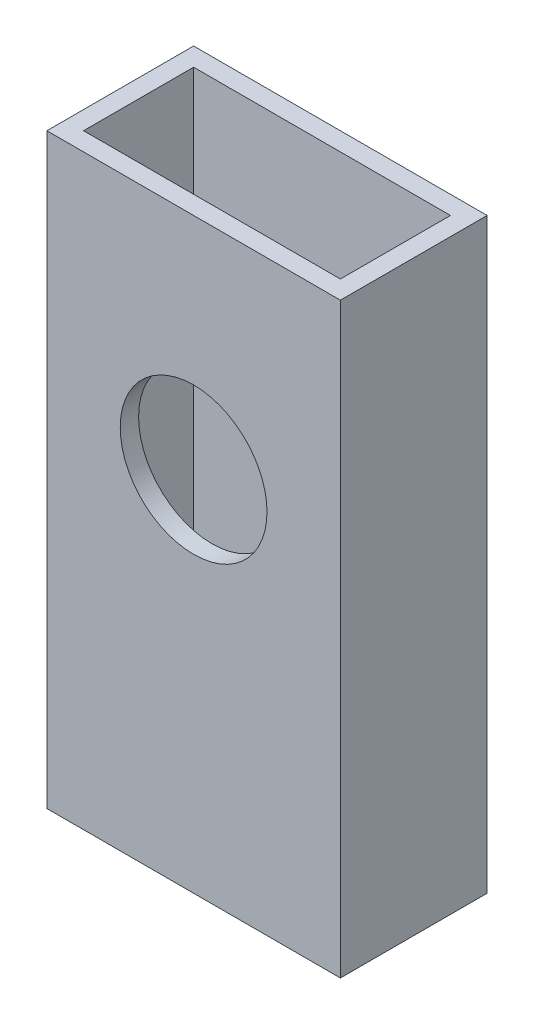
from build123d import *

# Parameters (mm, degrees)
SKETCH1_W           = 50.8
SKETCH1_H           = 101.6
BOSS_EXTRUDE1_DEPTH = 25.4
SKETCH2_W           = 44.45
SKETCH2_H           = 19.05
CUT_EXTRUDE1_DEPTH  = 117.397422652
SKETCH3_R           = 12.7
CUT_EXTRUDE2_DEPTH  = 6.35


with BuildPart() as part:
    # Sketch1 → Boss-Extrude1 (new body)
    with BuildSketch(Plane.XY):
        with Locations((25.4, 50.8)):
            Rectangle(SKETCH1_W, SKETCH1_H)
    extrude(amount=BOSS_EXTRUDE1_DEPTH)

    # Sketch2 → Cut-Extrude1 (cut, through all)
    with BuildSketch(Plane.XZ):
        with Locations((25.4, 12.7)):
            Rectangle(SKETCH2_W, SKETCH2_H)
    extrude(amount=-CUT_EXTRUDE1_DEPTH, mode=Mode.SUBTRACT)

    # Sketch3 → Cut-Extrude2 (cut)
    with BuildSketch(Plane.XY.offset(25.4)):
        with Locations((25.4, 63.5)):
            Circle(SKETCH3_R)
    extrude(amount=-CUT_EXTRUDE2_DEPTH, mode=Mode.SUBTRACT)


solid = part.part
